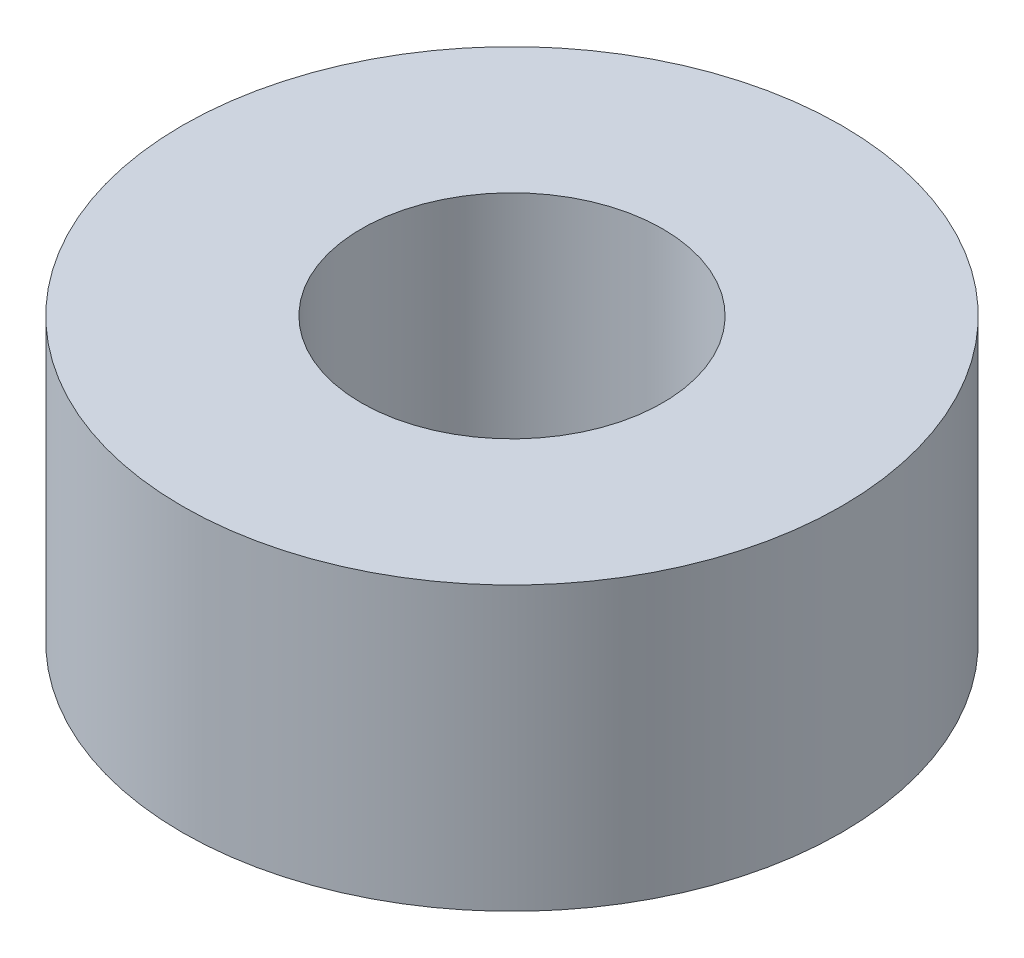
from build123d import *

# Parameters (mm, degrees)
SKETCH_1_R      = 3.5
SKETCH_1_R_2    = 1.6
EXTRUDE_1_DEPTH = 3


with BuildPart() as part:
    # 草图1 → 凸台-拉伸1 (new body)
    with BuildSketch(Plane(origin=(0, 0, 0), x_dir=(1, 0, 0), z_dir=(0, 1, 0))):
        with Locations(Location((0, 0, 0), (0, 0, 270))):
            Circle(SKETCH_1_R)
        with Locations(Location((0, 0, 0), (0, 0, 270))):
            Circle(SKETCH_1_R_2, mode=Mode.SUBTRACT)
    extrude(amount=EXTRUDE_1_DEPTH)


solid = part.part
